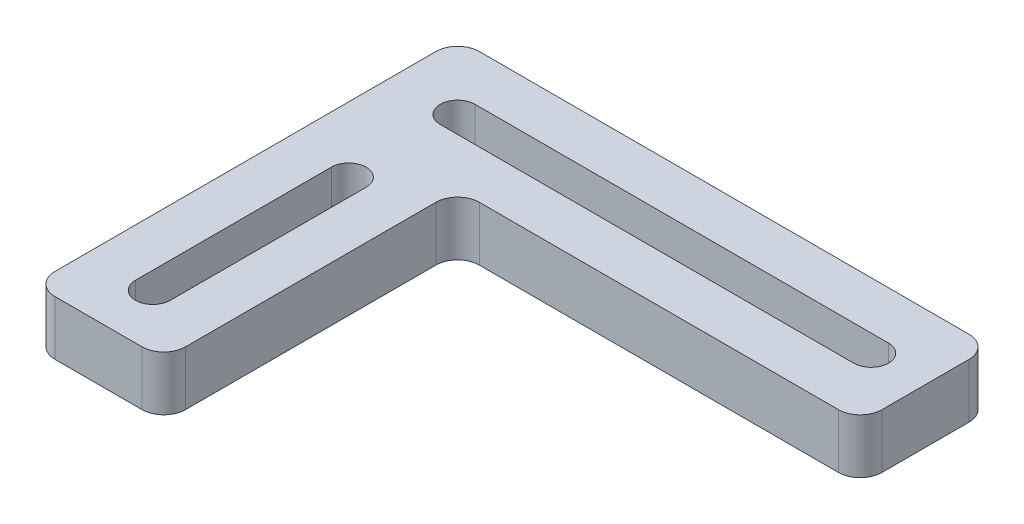
from build123d import *

# Parameters (mm, degrees)
BOSS_EXTRUDE1_DEPTH = 5


with BuildPart() as part:
    # Sketch1 → Boss-Extrude1 (new body)
    with BuildSketch(Plane(origin=(0, 0, 0), x_dir=(1, 0, 0), z_dir=(0, 1, 0))):
        with BuildLine():
            Line((0, -2), (8, -2))
            ThreePointArc((8, -2), (9.414213562, -1.414213562), (10, 0))
            Line((10, 0), (10, 23))
            ThreePointArc((10, 23), (10.585786438, 24.414213562), (12, 25))
            Line((12, 25), (45, 25))
            ThreePointArc((45, 25), (46.414213562, 25.585786438), (47, 27))
            Line((47, 27), (47, 35))
            ThreePointArc((47, 35), (46.414213562, 36.414213562), (45, 37))
            Line((45, 37), (0, 37))
            ThreePointArc((0, 37), (-1.414213562, 36.414213562), (-2, 35))
            Line((-2, 35), (-2, 0))
            ThreePointArc((-2, 0), (-1.414213562, -1.414213562), (0, -2))
        make_face()
        with BuildLine():
            Line((42, 29.4), (4, 29.4))
            ThreePointArc((4, 29.4), (2.4, 31), (4, 32.6))
            Line((4, 32.6), (42, 32.6))
            ThreePointArc((42, 32.6), (43.6, 31), (42, 29.4))
        make_face(mode=Mode.SUBTRACT)
        with BuildLine():
            Line((2.4, 3), (2.4, 21))
            ThreePointArc((2.4, 21), (4, 22.6), (5.6, 21))
            Line((5.6, 21), (5.6, 3))
            ThreePointArc((5.6, 3), (4, 1.4), (2.4, 3))
        make_face(mode=Mode.SUBTRACT)
    extrude(amount=BOSS_EXTRUDE1_DEPTH)


solid = part.part
